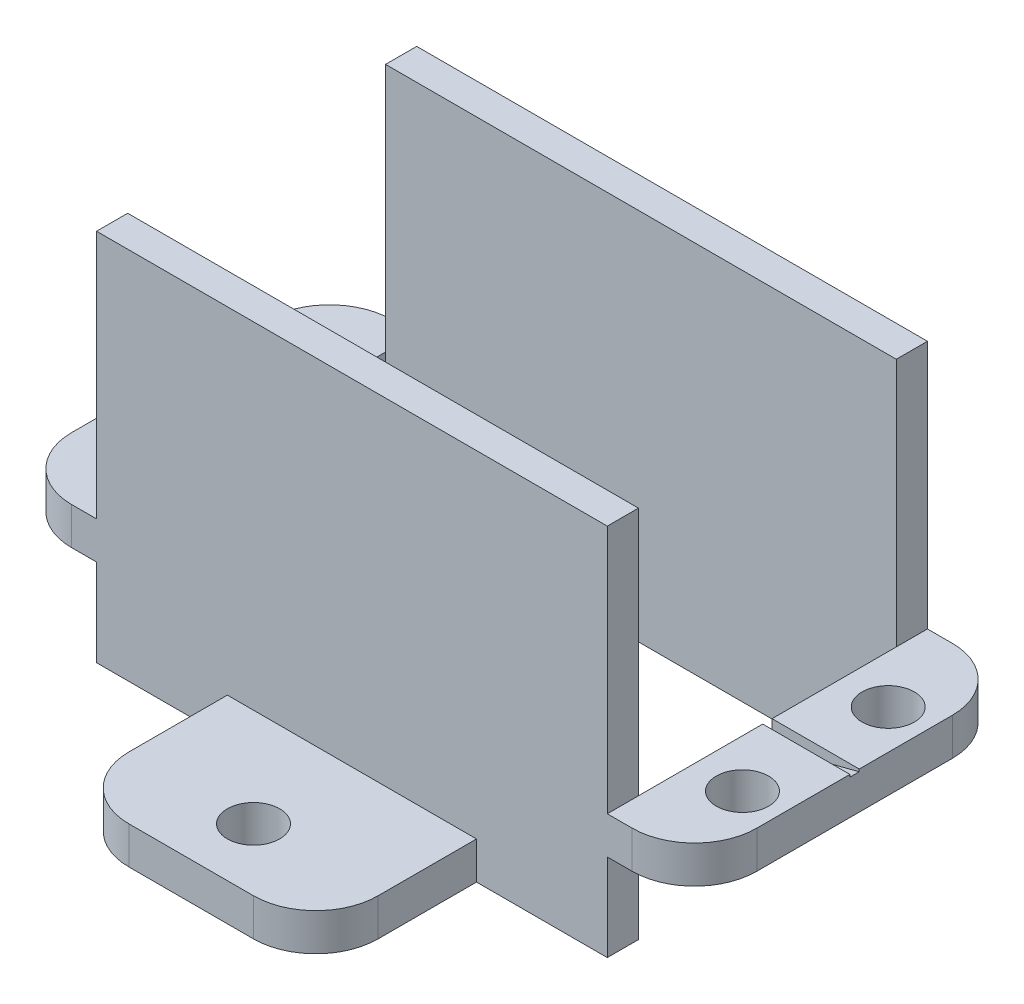
from build123d import *

# Parameters (mm, degrees)
SKETCH1_W            = 55
SKETCH1_H            = 25.7
BOSS_EXTRUDE1_DEPTH  = 3
SKETCH2_W            = 41
SKETCH2_H            = 20.7
CUT_EXTRUDE1_DEPTH   = 31.502008131
SKETCH3_R            = 2.1
CUT_EXTRUDE2_DEPTH   = 31.502008131
SKETCH4_W            = 41
SKETCH4_H            = 2.5
BOSS_EXTRUDE2_DEPTH  = 20
CUT_EXTRUDE3_DEPTH   = 0.375
FILLET1_R            = 5
SKETCH6_W            = 41
SKETCH6_H            = 2.5
BOSS_EXTRUDE3_DEPTH  = 7
SKETCH7_W            = 20
SKETCH7_H            = 3
BOSS_EXTRUDE4_DEPTH  = 12.9
SKETCH8_R            = 2.1
CUT_EXTRUDE4_DEPTH   = 47.349892125
FILLET2_R            = 5
FILLET2_OF_MIRROR5_R = 5


with BuildPart() as part:
    # Sketch1 → Boss-Extrude1 (new body)
    with BuildSketch(Plane(origin=(0, 0, 0), x_dir=(1, 0, 0), z_dir=(0, 1, 0))):
        Rectangle(SKETCH1_W, SKETCH1_H)
    extrude(amount=BOSS_EXTRUDE1_DEPTH)

    # Sketch2 → Cut-Extrude1 (cut, through all)
    with BuildSketch(Plane(origin=(0, 3, 0), x_dir=(1, 0, 0), z_dir=(0, 1, 0))):
        Rectangle(SKETCH2_W, SKETCH2_H)
    extrude(amount=-CUT_EXTRUDE1_DEPTH, mode=Mode.SUBTRACT)

    # Sketch3 → Cut-Extrude2 (cut, through all)
    with BuildSketch(Plane(origin=(0, 3, 0), x_dir=(1, 0, 0), z_dir=(0, 1, 0))):
        with Locations(Location((24.35, 5.85, 0), (0, 0, 270))):
            Circle(SKETCH3_R)
        with Locations(Location((24.35, -5.85, 0), (0, 0, 270))):
            Circle(SKETCH3_R)
    cut_extrude2 = extrude(amount=-CUT_EXTRUDE2_DEPTH, mode=Mode.SUBTRACT)

    # Mirror1: Cut-Extrude2 across plane
    add(cut_extrude2.mirror(Plane(origin=(0, 0, 0), x_dir=(0, 0, 1), z_dir=(1, 0, 0))), mode=Mode.SUBTRACT)

    # Sketch4 → Boss-Extrude2 (add)
    with BuildSketch(Plane(origin=(0, 3, 0), x_dir=(1, 0, 0), z_dir=(0, 1, 0))):
        with Locations((0, 11.6)):
            Rectangle(SKETCH4_W, SKETCH4_H)
        with Locations((0, -11.6)):
            Rectangle(SKETCH4_W, SKETCH4_H)
    extrude(amount=BOSS_EXTRUDE2_DEPTH)

    # Sketch5 → Cut-Extrude3 (cut, symmetric)
    with BuildSketch(Plane.XY):
        Polygon((20.5, 1), (20.5, 3), (28.245966692, 3), align=None)
    cut_extrude3 = extrude(amount=CUT_EXTRUDE3_DEPTH, both=True, mode=Mode.SUBTRACT)

    # Mirror2: Cut-Extrude3 across plane
    add(cut_extrude3.mirror(Plane(origin=(0, 0, 0), x_dir=(0, 0, 1), z_dir=(1, 0, 0))), mode=Mode.SUBTRACT)

    # Fillet1
    fillet1_edges = [part.edges().sort_by_distance(p)[0] for p in [
        (-27.5, 1.5, -12.85),
        (27.5, 1.5, -12.85),
        (27.5, 1.5, 12.85),
        (-27.5, 1.5, 12.85),
    ]]
    fillet(fillet1_edges, radius=FILLET1_R)

    # Sketch6 → Boss-Extrude3 (add)
    with BuildSketch(Plane.XZ):
        with Locations((0, 11.6)):
            Rectangle(SKETCH6_W, SKETCH6_H)
        with Locations((0, -11.6)):
            Rectangle(SKETCH6_W, SKETCH6_H)
    extrude(amount=BOSS_EXTRUDE3_DEPTH)

    # Sketch7 → Boss-Extrude4 (add)
    with BuildSketch(Plane.XY.offset(12.85)):
        with Locations((0, -5.5)):
            Rectangle(SKETCH7_W, SKETCH7_H)
    boss_extrude4 = extrude(amount=BOSS_EXTRUDE4_DEPTH)

    # Sketch8 → Cut-Extrude4 (cut, through all)
    with BuildSketch(Plane(origin=(0, -4, 0), x_dir=(1, 0, 0), z_dir=(0, 1, 0))):
        with Locations(Location((0, -20.75, 0), (0, 0, 270))):
            Circle(SKETCH8_R)
    cut_extrude4 = extrude(amount=-CUT_EXTRUDE4_DEPTH, mode=Mode.SUBTRACT)

    # Fillet2
    fillet2_edges = [part.edges().sort_by_distance(p)[0] for p in [
        (-10, -5.5, 25.75),
        (10, -5.5, 25.75),
    ]]
    fillet(fillet2_edges, radius=FILLET2_R)

    # Mirror5: Boss-Extrude4, Cut-Extrude4 across plane
    add(boss_extrude4.mirror(Plane.XY))
    add(cut_extrude4.mirror(Plane.XY), mode=Mode.SUBTRACT)

    # Fillet2 of Mirror5
    fillet2_of_mirror5_edges = [part.edges().sort_by_distance(p)[0] for p in [
        (-10, -5.5, -25.75),
        (10, -5.5, -25.75),
    ]]
    fillet(fillet2_of_mirror5_edges, radius=FILLET2_OF_MIRROR5_R)


solid = part.part
